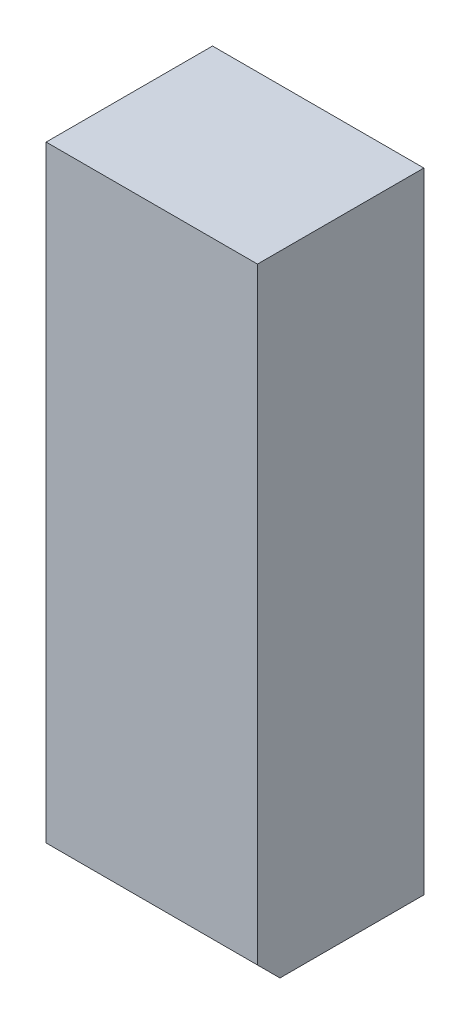
from build123d import *

# Parameters (mm, degrees)
BOSS_EXTRUDE1_DEPTH = 47


with BuildPart() as part:
    # Sketch1 → Boss-Extrude1 (new body)
    with BuildSketch(Plane(origin=(0, 0, 0), x_dir=(0, -1, 0), z_dir=(-1, 0, 0))):
        Polygon((140, 0), (140, 32), (135, 37), (0, 37), (0, 0), align=None)
    extrude(amount=-BOSS_EXTRUDE1_DEPTH)


solid = part.part
